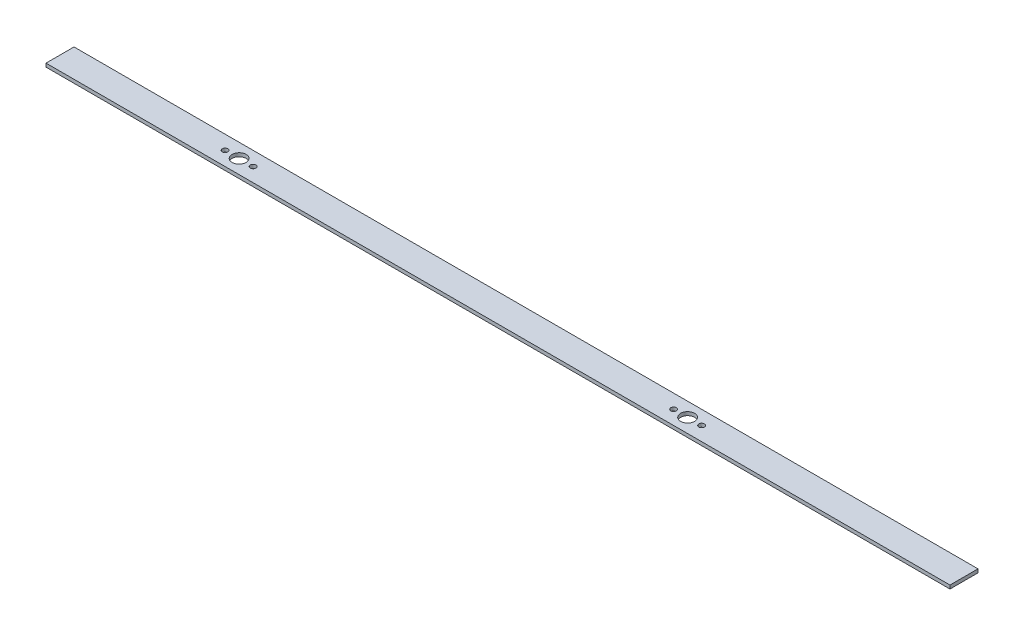
from build123d import *

# Parameters (mm, degrees)
SKETCH1_W           = 819.15
SKETCH1_H           = 25.4
BOSS_EXTRUDE1_DEPTH = 3.175
SKETCH2_R           = 2.5146
SKETCH2_R_2         = 6.35
CUT_EXTRUDE1_DEPTH  = 820.549853959


with BuildPart() as part:
    # Sketch1 → Boss-Extrude1 (new body)
    with BuildSketch(Plane(origin=(0, 0, 0), x_dir=(1, 0, 0), z_dir=(0, 1, 0))):
        with Locations((409.575, 12.7)):
            Rectangle(SKETCH1_W, SKETCH1_H)
    extrude(amount=BOSS_EXTRUDE1_DEPTH)

    # Sketch2 → Cut-Extrude1 (cut, through all)
    with BuildSketch(Plane(origin=(0, 3.175, 0), x_dir=(1, 0, 0), z_dir=(0, 1, 0))):
        with Locations(Location((149.597837435, 12.7, 0), (0, 0, 270))):
            Circle(SKETCH2_R)
        with Locations(Location((174.997837435, 12.7, 0), (0, 0, 270))):
            Circle(SKETCH2_R)
        with Locations(Location((555.997837435, 12.7, 0), (0, 0, 270))):
            Circle(SKETCH2_R)
        with Locations(Location((581.397837435, 12.7, 0), (0, 0, 270))):
            Circle(SKETCH2_R)
        with Locations(Location((162.297837435, 12.7, 0), (0, 0, 270))):
            Circle(SKETCH2_R_2)
        with Locations(Location((568.697837435, 12.7, 0), (0, 0, 270))):
            Circle(SKETCH2_R_2)
    extrude(amount=-CUT_EXTRUDE1_DEPTH, mode=Mode.SUBTRACT)


solid = part.part
